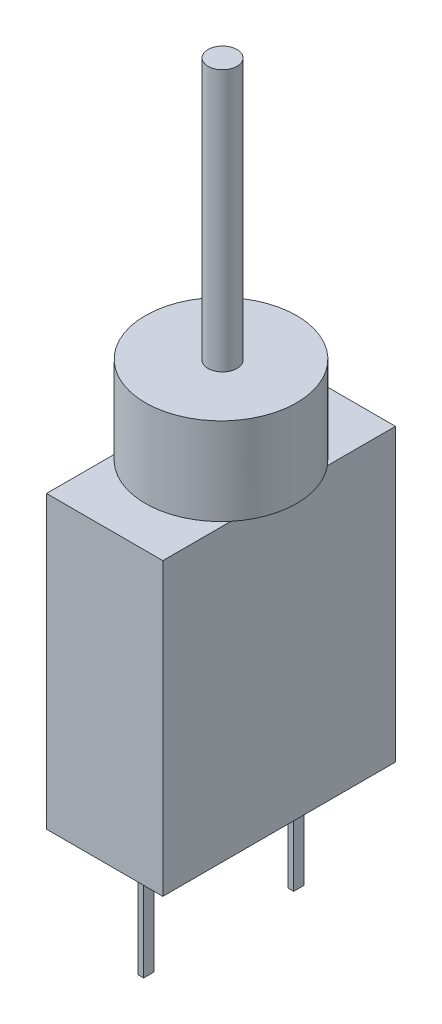
from build123d import *

# Parameters (mm, degrees)
ESQUISSE1_W        = 8
ESQUISSE1_H        = 10
BOSS_EXTRU_1_DEPTH = 4
ESQUISSE2_W        = 0.201235696
ESQUISSE2_H        = 0.359902984
BOSS_EXTRU_2_DEPTH = 4
ESQUISSE3_R        = 2.6
BOSS_EXTRU_3_DEPTH = 3
ESQUISSE4_R        = 0.5
BOSS_EXTRU_4_DEPTH = 9


with BuildPart() as part:
    # Esquisse1 → Boss.-Extru.1 (new body)
    with BuildSketch(Plane(origin=(0, 0, 0), x_dir=(0, 0, -1), z_dir=(1, 0, 0))):
        Rectangle(ESQUISSE1_W, ESQUISSE1_H)
    extrude(amount=BOSS_EXTRU_1_DEPTH)

    # Esquisse2 → Boss.-Extru.2 (add)
    with BuildSketch(Plane.XZ.offset(5)):
        with Locations((2, 2.580715462)):
            Rectangle(ESQUISSE2_W, ESQUISSE2_H)
    boss_extru_2 = extrude(amount=BOSS_EXTRU_2_DEPTH)

    # Symétrie1: Boss.-Extru.2 across plane
    add(boss_extru_2.mirror(Plane.XY))

    # Esquisse3 → Boss.-Extru.3 (add)
    with BuildSketch(Plane(origin=(0, 5, 0), x_dir=(1, 0, 0), z_dir=(0, 1, 0))):
        with Locations(Location((2, 0, 0), (0, 0, 39.715137232))):
            Circle(ESQUISSE3_R)
    extrude(amount=BOSS_EXTRU_3_DEPTH)

    # Esquisse4 → Boss.-Extru.4 (add)
    with BuildSketch(Plane(origin=(0, 8, 0), x_dir=(1, 0, 0), z_dir=(0, 1, 0))):
        with Locations(Location((2.053541677, 0, 0), (0, 0, 270))):
            Circle(ESQUISSE4_R)
    extrude(amount=BOSS_EXTRU_4_DEPTH)


solid = part.part
